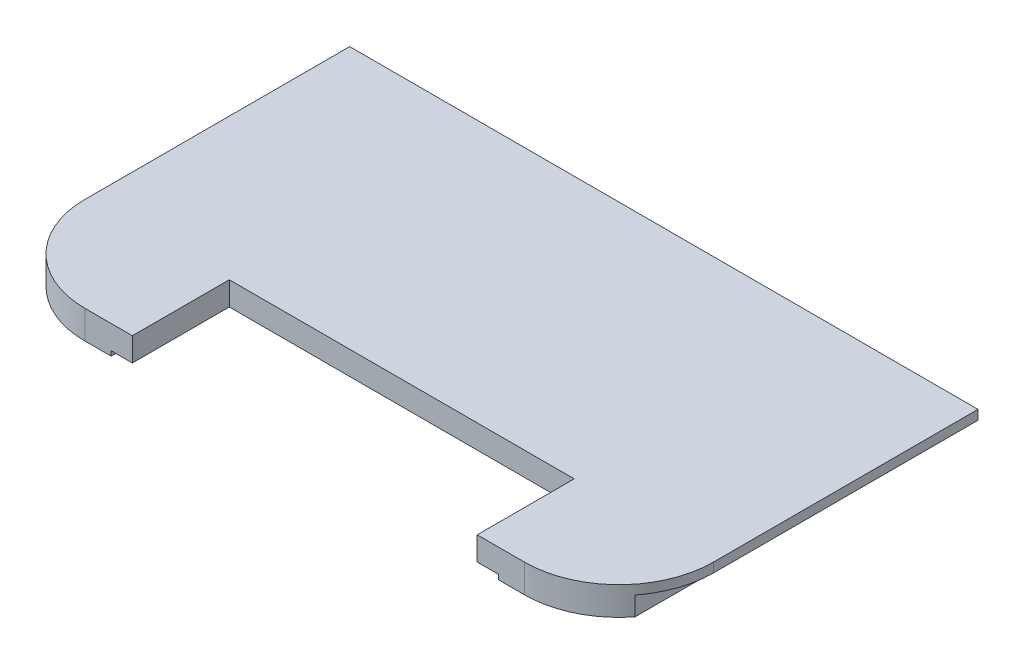
from build123d import *

# Parameters (mm, degrees)
SKETCH1_W           = 422.275
SKETCH1_H           = 241.3
BOSS_EXTRUDE1_DEPTH = 19.05
CUT_EXTRUDE1_REACH  = 245.923
SKETCH2_W           = 231.775
SKETCH2_H           = 65.151
CUT_EXTRUDE2_REACH  = 323.197
SKETCH3_W           = 14.2875
SKETCH3_H           = 3.175
CUT_EXTRUDE3_REACH  = 323.197
SKETCH4_W           = 13.49375
SKETCH4_H           = 3.175
FILLET1_R           = 63.5
CUT_EXTRUDE4_REACH  = 323.197
SKETCH5_W           = 13.49375
SKETCH5_H           = 9.525
CHAMFER1_SIZE       = 3.175
CHAMFER1_SIZE2      = 11.849261314


with BuildPart() as part:
    # Sketch1 → Boss-Extrude1 (new body)
    with BuildSketch(Plane(origin=(0, 0, 0), x_dir=(1, 0, 0), z_dir=(0, 1, 0))):
        Rectangle(SKETCH1_W, SKETCH1_H)
    extrude(amount=BOSS_EXTRUDE1_DEPTH)

    # Sketch2 → Cut-Extrude1 (cut, up to next)
    with BuildSketch(Plane(origin=(0, 19.05, 0), x_dir=(1, 0, 0), z_dir=(0, 1, 0)), mode=Mode.PRIVATE) as cut_extrude1_sk1:
        with Locations((0, -88.0745)):
            Rectangle(SKETCH2_W, SKETCH2_H)
    cut_extrude1_tool1 = extrude(cut_extrude1_sk1.sketch, amount=-CUT_EXTRUDE1_REACH, mode=Mode.PRIVATE) & part.part
    add(cut_extrude1_tool1.solids().sort_by_distance((0, 19.05, 88.0745))[0], mode=Mode.SUBTRACT)

    # Sketch3 → Cut-Extrude2 (cut, up to next)
    with BuildSketch(Plane.XY.offset(120.65), mode=Mode.PRIVATE) as cut_extrude2_sk1:
        with Locations((-123.03125, 1.5875)):
            Rectangle(SKETCH3_W, SKETCH3_H)
    cut_extrude2_tool1 = extrude(cut_extrude2_sk1.sketch, amount=-CUT_EXTRUDE2_REACH, mode=Mode.PRIVATE) & part.part
    # Sketch3 → Cut-Extrude2 (cut, up to next)
    with BuildSketch(Plane.XY.offset(120.65), mode=Mode.PRIVATE) as cut_extrude2_sk2:
        with Locations((123.03125, 1.5875)):
            Rectangle(SKETCH3_W, SKETCH3_H)
    cut_extrude2_tool2 = extrude(cut_extrude2_sk2.sketch, amount=-CUT_EXTRUDE2_REACH, mode=Mode.PRIVATE) & part.part
    add(cut_extrude2_tool1.solids().sort_by_distance((-123.03125, 1.5875, 120.65))[0], mode=Mode.SUBTRACT)
    add(cut_extrude2_tool2.solids().sort_by_distance((123.03125, 1.5875, 120.65))[0], mode=Mode.SUBTRACT)

    # Sketch4 → Cut-Extrude3 (cut, up to next)
    with BuildSketch(Plane.XY.offset(120.65), mode=Mode.PRIVATE) as cut_extrude3_sk1:
        with Locations((-204.390625, 1.5875)):
            Rectangle(SKETCH4_W, SKETCH4_H)
    cut_extrude3_tool1 = extrude(cut_extrude3_sk1.sketch, amount=-CUT_EXTRUDE3_REACH, mode=Mode.PRIVATE) & part.part
    # Sketch4 → Cut-Extrude3 (cut, up to next)
    with BuildSketch(Plane.XY.offset(120.65), mode=Mode.PRIVATE) as cut_extrude3_sk2:
        with Locations((204.390625, 1.5875)):
            Rectangle(SKETCH4_W, SKETCH4_H)
    cut_extrude3_tool2 = extrude(cut_extrude3_sk2.sketch, amount=-CUT_EXTRUDE3_REACH, mode=Mode.PRIVATE) & part.part
    add(cut_extrude3_tool1.solids().sort_by_distance((-204.390625, 1.5875, 120.65))[0], mode=Mode.SUBTRACT)
    add(cut_extrude3_tool2.solids().sort_by_distance((204.390625, 1.5875, 120.65))[0], mode=Mode.SUBTRACT)

    # Fillet1
    fillet1_edges = [part.edges().sort_by_distance(p)[0] for p in [
        (211.1375, 11.1125, 120.65),
        (-211.1375, 11.1125, 120.65),
    ]]
    fillet(fillet1_edges, radius=FILLET1_R)

    # Sketch5 → Cut-Extrude4 (cut, up to next)
    with BuildSketch(Plane(origin=(0, 0, -120.65), x_dir=(-1, 0, 0), z_dir=(0, 0, -1)), mode=Mode.PRIVATE) as cut_extrude4_sk1:
        with Locations((-204.390625, 7.9375)):
            Rectangle(SKETCH5_W, SKETCH5_H)
    cut_extrude4_tool1 = extrude(cut_extrude4_sk1.sketch, amount=-CUT_EXTRUDE4_REACH, mode=Mode.PRIVATE) & part.part
    # Sketch5 → Cut-Extrude4 (cut, up to next)
    with BuildSketch(Plane(origin=(0, 0, -120.65), x_dir=(-1, 0, 0), z_dir=(0, 0, -1)), mode=Mode.PRIVATE) as cut_extrude4_sk2:
        with Locations((204.390625, 7.9375)):
            Rectangle(SKETCH5_W, SKETCH5_H)
    cut_extrude4_tool2 = extrude(cut_extrude4_sk2.sketch, amount=-CUT_EXTRUDE4_REACH, mode=Mode.PRIVATE) & part.part
    add(cut_extrude4_tool1.solids().sort_by_distance((204.390625, 7.9375, -120.65))[0], mode=Mode.SUBTRACT)
    add(cut_extrude4_tool2.solids().sort_by_distance((-204.390625, 7.9375, -120.65))[0], mode=Mode.SUBTRACT)

    # Chamfer1
    chamfer1_edges = [part.edges().sort_by_distance(p)[0] for p in [
        (0, 0, 55.499),
    ]]
    chamfer1_side = [part.faces().sort_by_distance(p)[0] for p in [
        (0, 9.525, 55.499),
    ]]
    chamfer(chamfer1_edges, length=CHAMFER1_SIZE, length2=CHAMFER1_SIZE2, reference=chamfer1_side[0])


solid = part.part
